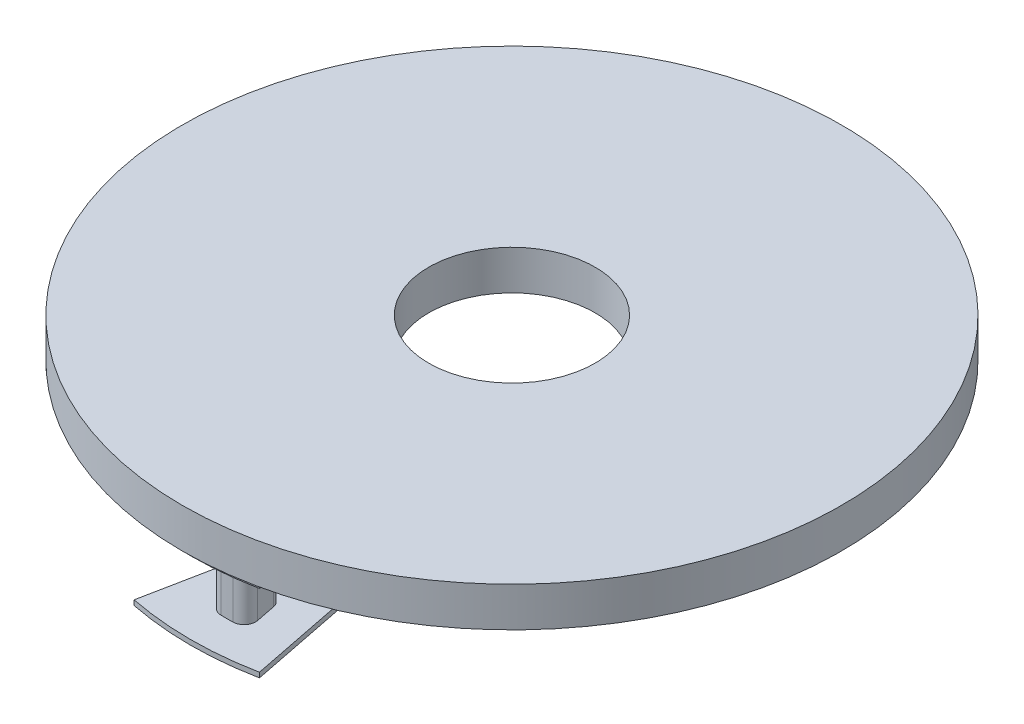
from build123d import *

# Parameters (mm, degrees)
SKETCH1_R               = 100
BOSS_EXTRUDE1_DEPTH     = 6
SKETCH2_W               = 10.25
SKETCH2_H               = 10.25
CUT_EXTRUDE1_DEPTH      = 10
CUT_EXTRUDE2_DEPTH      = 142.929559994
CUT_EXTRUDE2_DEPTH_BACK = 142.929559994
SKETCH3_R               = 25.25
BOSS_EXTRUDE2_START     = 1
BOSS_EXTRUDE2_DEPTH     = 1.5
BOSS_EXTRUDE3_DEPTH     = 22
BOSS_EXTRUDE4_DEPTH     = 1.5
CUT_EXTRUDE3_DEPTH      = 144.614066163
CUT_EXTRUDE3_DEPTH_BACK = 144.614066163
CUT_EXTRUDE4_DEPTH      = 144.614066163
CUT_EXTRUDE4_DEPTH_BACK = 144.614066163


with BuildPart() as part:
    # Sketch1 → Boss-Extrude1 (new, symmetric)
    with BuildSketch(Plane(origin=(0, 0, 0), x_dir=(1, 0, 0), z_dir=(0, 1, 0))):
        with Locations(Location((0, 0, 0), (0, 0, 270))):
            Circle(SKETCH1_R)
    extrude(amount=BOSS_EXTRUDE1_DEPTH, both=True)

    # Sketch2 → Cut-Extrude1 (cut)
    with BuildSketch(Plane.XZ.offset(6)):
        Polygon((11.775629422, 85.469970175), (9.775953621, 75.416921051), (19.829002745, 73.41724525), (21.828678546, 83.470294374), align=None)
        with Locations((0, 81)):
            Rectangle(SKETCH2_W, SKETCH2_H)
        Polygon((28.223728008, 81.530377328), (24.301222827, 72.06061212), (33.770988035, 68.138106938), (37.693493217, 77.607872147), align=None)
        Polygon((43.587204556, 74.457617804), (37.892609667, 65.935054278), (46.415173193, 60.240459389), (52.109768082, 68.763022915), align=None)
        Polygon((57.275649276, 64.523493783), (50.027804769, 57.275649276), (57.275649276, 50.027804769), (64.523493783, 57.275649276), align=None)
        Polygon((68.763022915, 52.109768082), (60.240459389, 46.415173193), (65.935054278, 37.892609667), (74.457617804, 43.587204556), align=None)
        Polygon((77.607872147, 37.693493217), (68.138106938, 33.770988035), (72.06061212, 24.301222827), (81.530377328, 28.223728008), align=None)
        Polygon((83.470294374, 21.828678546), (73.41724525, 19.829002745), (75.416921051, 9.775953621), (85.469970175, 11.775629422), align=None)
        with Locations((81, 0)):
            Rectangle(SKETCH2_W, SKETCH2_H)
        Polygon((85.469970175, -11.775629422), (75.416921051, -9.775953621), (73.41724525, -19.829002745), (83.470294374, -21.828678546), align=None)
        Polygon((81.530377328, -28.223728008), (72.06061212, -24.301222827), (68.138106938, -33.770988035), (77.607872147, -37.693493217), align=None)
        Polygon((74.457617804, -43.587204556), (65.935054278, -37.892609667), (60.240459389, -46.415173193), (68.763022915, -52.109768082), align=None)
        Polygon((64.523493783, -57.275649276), (57.275649276, -50.027804769), (50.027804769, -57.275649276), (57.275649276, -64.523493783), align=None)
        Polygon((52.109768082, -68.763022915), (46.415173193, -60.240459389), (37.892609667, -65.935054278), (43.587204556, -74.457617804), align=None)
        Polygon((37.693493217, -77.607872147), (33.770988035, -68.138106938), (24.301222827, -72.06061212), (28.223728008, -81.530377328), align=None)
        Polygon((21.828678546, -83.470294374), (19.829002745, -73.41724525), (9.775953621, -75.416921051), (11.775629422, -85.469970175), align=None)
        with Locations((0, -81)):
            Rectangle(SKETCH2_W, SKETCH2_H)
        Polygon((-11.775629422, -85.469970175), (-9.775953621, -75.416921051), (-19.829002745, -73.41724525), (-21.828678546, -83.470294374), align=None)
        Polygon((-28.223728008, -81.530377328), (-24.301222827, -72.06061212), (-33.770988035, -68.138106938), (-37.693493217, -77.607872147), align=None)
        Polygon((-43.587204556, -74.457617804), (-37.892609667, -65.935054278), (-46.415173193, -60.240459389), (-52.109768082, -68.763022915), align=None)
        Polygon((-57.275649276, -64.523493783), (-50.027804769, -57.275649276), (-57.275649276, -50.027804769), (-64.523493783, -57.275649276), align=None)
        Polygon((-68.763022915, -52.109768082), (-60.240459389, -46.415173193), (-65.935054278, -37.892609667), (-74.457617804, -43.587204556), align=None)
        Polygon((-77.607872147, -37.693493217), (-68.138106938, -33.770988035), (-72.06061212, -24.301222827), (-81.530377328, -28.223728008), align=None)
        Polygon((-83.470294374, -21.828678546), (-73.41724525, -19.829002745), (-75.416921051, -9.775953621), (-85.469970175, -11.775629422), align=None)
        with Locations((-81, 0)):
            Rectangle(SKETCH2_W, SKETCH2_H)
        Polygon((-85.469970175, 11.775629422), (-75.416921051, 9.775953621), (-73.41724525, 19.829002745), (-83.470294374, 21.828678546), align=None)
        Polygon((-81.530377328, 28.223728008), (-72.06061212, 24.301222827), (-68.138106938, 33.770988035), (-77.607872147, 37.693493217), align=None)
        Polygon((-74.457617804, 43.587204556), (-65.935054278, 37.892609667), (-60.240459389, 46.415173193), (-68.763022915, 52.109768082), align=None)
        Polygon((-64.523493783, 57.275649276), (-57.275649276, 50.027804769), (-50.027804769, 57.275649276), (-57.275649276, 64.523493783), align=None)
        Polygon((-52.109768082, 68.763022915), (-46.415173193, 60.240459389), (-37.892609667, 65.935054278), (-43.587204556, 74.457617804), align=None)
        Polygon((-37.693493217, 77.607872147), (-33.770988035, 68.138106938), (-24.301222827, 72.06061212), (-28.223728008, 81.530377328), align=None)
        Polygon((-21.828678546, 83.470294374), (-19.829002745, 73.41724525), (-9.775953621, 75.416921051), (-11.775629422, 85.469970175), align=None)
    extrude(amount=-CUT_EXTRUDE1_DEPTH, mode=Mode.SUBTRACT)

    # Sketch3 → Cut-Extrude2 (cut, two sides: drawn at the far end of the back side and taken through both)
    with BuildSketch(Plane(origin=(0, 6, 0), x_dir=(1, 0, 0), z_dir=(0, 1, 0)).offset(-CUT_EXTRUDE2_DEPTH_BACK)):
        with Locations(Location((0, 0, 0), (0, 0, 270))):
            Circle(SKETCH3_R)
    extrude(amount=CUT_EXTRUDE2_DEPTH + CUT_EXTRUDE2_DEPTH_BACK, mode=Mode.SUBTRACT)


with BuildPart() as body_2:
    # Sketch5 → Boss-Extrude2 (new body)
    with BuildSketch(Plane.XZ.offset(6).offset(BOSS_EXTRUDE2_START)):
        with BuildLine():
            Line((-19.021306397, 95.626564839), (-12.193145126, 61.299080025))
            Line((-12.193145126, 61.299080025), (12.193145126, 61.299080025))
            Line((12.193145126, 61.299080025), (19.021306397, 95.626564839))
            ThreePointArc((19.021306397, 95.626564839), (0, 97.5), (-19.021306397, 95.626564839))
        make_face()
        with BuildLine():
            Line((3.683671258, 82.591952187), (2.49338574, 76.607982793))
            ThreePointArc((2.49338574, 76.607982793), (1.795255206, 75.447770164), (0.518001798, 74.99821114))
            ThreePointArc((0.518001798, 74.99821114), (0, 75), (-0.518001798, 74.99821114))
            ThreePointArc((-0.518001798, 74.99821114), (-1.795255206, 75.447770164), (-2.49338574, 76.607982793))
            Line((-2.49338574, 76.607982793), (-3.683671258, 82.591952187))
            ThreePointArc((-3.683671258, 82.591952187), (-3.281201628, 84.234811676), (-1.7635971, 84.981702297))
            ThreePointArc((-1.7635971, 84.981702297), (0, 85), (1.7635971, 84.981702297))
            ThreePointArc((1.7635971, 84.981702297), (3.281201628, 84.234811676), (3.683671258, 82.591952187))
        make_face(mode=Mode.SUBTRACT)
    extrude(amount=BOSS_EXTRUDE2_DEPTH)

    # Sketch6 → Boss-Extrude3 (add)
    with BuildSketch(Plane.XZ.offset(8.5)):
        with BuildLine():
            Line((-5.154849179, 82.299316704), (-3.96456366, 76.31534731))
            ThreePointArc((-3.96456366, 76.31534731), (-2.742835226, 74.28497521), (-0.507641762, 73.498246917))
            ThreePointArc((-0.507641762, 73.498246917), (0, 73.5), (0.507641762, 73.498246917))
            ThreePointArc((0.507641762, 73.498246917), (2.742835226, 74.28497521), (3.96456366, 76.31534731))
            Line((3.96456366, 76.31534731), (5.154849179, 82.299316704))
            ThreePointArc((5.154849179, 82.299316704), (4.450527326, 85.17432081), (1.794719402, 86.481379396))
            ThreePointArc((1.794719402, 86.481379396), (0, 86.5), (-1.794719402, 86.481379396))
            ThreePointArc((-1.794719402, 86.481379396), (-4.450527326, 85.17432081), (-5.154849179, 82.299316704))
        make_face()
        with BuildLine():
            Line((-3.683671258, 82.591952187), (-2.49338574, 76.607982793))
            ThreePointArc((-2.49338574, 76.607982793), (-1.795255206, 75.447770164), (-0.518001798, 74.99821114))
            ThreePointArc((-0.518001798, 74.99821114), (0, 75), (0.518001798, 74.99821114))
            ThreePointArc((0.518001798, 74.99821114), (1.795255206, 75.447770164), (2.49338574, 76.607982793))
            Line((2.49338574, 76.607982793), (3.683671258, 82.591952187))
            ThreePointArc((3.683671258, 82.591952187), (3.281201628, 84.234811676), (1.7635971, 84.981702297))
            ThreePointArc((1.7635971, 84.981702297), (0, 85), (-1.7635971, 84.981702297))
            ThreePointArc((-1.7635971, 84.981702297), (-3.281201628, 84.234811676), (-3.683671258, 82.591952187))
        make_face(mode=Mode.SUBTRACT)
    extrude(amount=BOSS_EXTRUDE3_DEPTH)

    # Sketch7 → Boss-Extrude4 (add)
    with BuildSketch(Plane.XZ.offset(30.5)):
        with BuildLine():
            Line((-19.021306397, 95.626564839), (-12.193145126, 61.299080025))
            Line((-12.193145126, 61.299080025), (12.193145126, 61.299080025))
            Line((12.193145126, 61.299080025), (19.021306397, 95.626564839))
            ThreePointArc((19.021306397, 95.626564839), (0, 97.5), (-19.021306397, 95.626564839))
        make_face()
        with BuildLine():
            Line((-3.683671258, 82.591952187), (-2.49338574, 76.607982793))
            ThreePointArc((-2.49338574, 76.607982793), (-1.795255206, 75.447770164), (-0.518001798, 74.99821114))
            ThreePointArc((-0.518001798, 74.99821114), (0, 75), (0.518001798, 74.99821114))
            ThreePointArc((0.518001798, 74.99821114), (1.795255206, 75.447770164), (2.49338574, 76.607982793))
            Line((2.49338574, 76.607982793), (3.683671258, 82.591952187))
            ThreePointArc((3.683671258, 82.591952187), (3.281201628, 84.234811676), (1.7635971, 84.981702297))
            ThreePointArc((1.7635971, 84.981702297), (0, 85), (-1.7635971, 84.981702297))
            ThreePointArc((-1.7635971, 84.981702297), (-3.281201628, 84.234811676), (-3.683671258, 82.591952187))
        make_face(mode=Mode.SUBTRACT)
    extrude(amount=BOSS_EXTRUDE4_DEPTH)

    # Sketch8 → Cut-Extrude3 (cut, two sides: drawn at the far end of the back side and taken through both)
    with BuildSketch(Plane(origin=(0, -7, 0), x_dir=(1, 0, 0), z_dir=(0, 1, 0)).offset(-CUT_EXTRUDE3_DEPTH_BACK)):
        Polygon((-12.392057493, -62.299080025), (12.392057493, -62.299080025), (12.193145126, -61.299080025), (-12.193145126, -61.299080025), align=None)
    extrude(amount=CUT_EXTRUDE3_DEPTH + CUT_EXTRUDE3_DEPTH_BACK, mode=Mode.SUBTRACT)

    # Sketch9 → Cut-Extrude4 (cut, two sides: drawn at the far end of the back side and taken through both)
    with BuildSketch(Plane(origin=(0, -7, 0), x_dir=(1, 0, 0), z_dir=(0, 1, 0)).offset(-CUT_EXTRUDE4_DEPTH_BACK)):
        with BuildLine():
            Line((-2.98377838, -76.510437632), (-4.174063899, -82.494407026))
            ThreePointArc((-4.174063899, -82.494407026), (-3.670976861, -84.547981387), (-1.773971201, -85.481594663))
            ThreePointArc((-1.773971201, -85.481594663), (0, -85.5), (1.773971201, -85.481594663))
            ThreePointArc((1.773971201, -85.481594663), (3.670976861, -84.547981387), (4.174063899, -82.494407026))
            Line((4.174063899, -82.494407026), (2.98377838, -76.510437632))
            ThreePointArc((2.98377838, -76.510437632), (2.111115213, -75.060171846), (0.514548452, -74.498223065))
            ThreePointArc((0.514548452, -74.498223065), (0, -74.5), (-0.514548452, -74.498223065))
            ThreePointArc((-0.514548452, -74.498223065), (-2.111115213, -75.060171846), (-2.98377838, -76.510437632))
        make_face()
    extrude(amount=CUT_EXTRUDE4_DEPTH + CUT_EXTRUDE4_DEPTH_BACK, mode=Mode.SUBTRACT)


solid = Compound([part.part, body_2.part])
